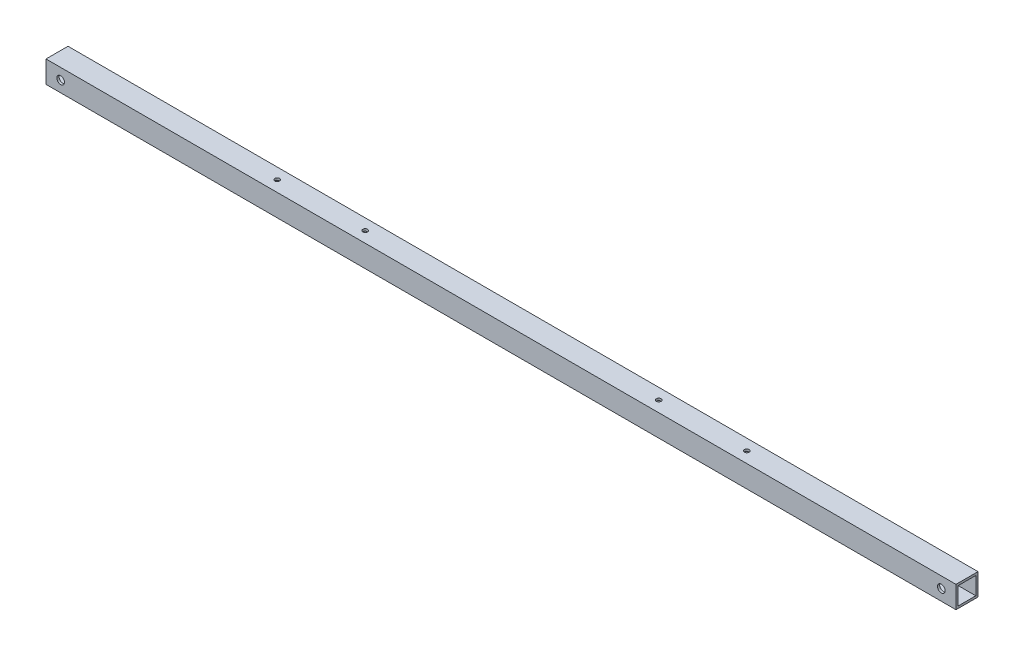
from build123d import *

# Parameters (mm, degrees)
SKETCH_2_W          = 620
SKETCH_2_H          = 15
SKETCH_2_R          = 2.6
EXTRUDE_1_DEPTH     = 15
SKETCH_3_W          = 12
SKETCH_3_H          = 12
CUT_EXTRUDE_1_DEPTH = 621.362797079
SKETCH_4_R          = 1.6
CUT_EXTRUDE_2_DEPTH = 621.362797079


with BuildPart() as part:
    # ｽｹｯﾁ2 → ﾎﾞｽ - 押し出し1 (new body)
    with BuildSketch(Plane.XY):
        with Locations((310, 7.5)):
            Rectangle(SKETCH_2_W, SKETCH_2_H)
        with Locations((10, 7.5)):
            Circle(SKETCH_2_R, mode=Mode.SUBTRACT)
        with Locations((610, 7.5)):
            Circle(SKETCH_2_R, mode=Mode.SUBTRACT)
    extrude(amount=EXTRUDE_1_DEPTH)

    # ｽｹｯﾁ3 → ｶｯﾄ - 押し出し1 (cut, through all)
    with BuildSketch(Plane.ZY):
        with Locations((7.5, 7.5)):
            Rectangle(SKETCH_3_W, SKETCH_3_H)
    extrude(amount=-CUT_EXTRUDE_1_DEPTH, mode=Mode.SUBTRACT)

    # ｽｹｯﾁ4 → ｶｯﾄ - 押し出し2 (cut, through all)
    with BuildSketch(Plane(origin=(0, 15, 0), x_dir=(1, 0, 0), z_dir=(0, 1, 0))):
        with Locations(Location((470, -7.5, 0), (0, 0, 270))):
            Circle(SKETCH_4_R)
        with Locations(Location((410, -7.5, 0), (0, 0, 270))):
            Circle(SKETCH_4_R)
        with Locations(Location((150, -7.5, 0), (0, 0, 270))):
            Circle(SKETCH_4_R)
        with Locations(Location((210, -7.5, 0), (0, 0, 270))):
            Circle(SKETCH_4_R)
    extrude(amount=-CUT_EXTRUDE_2_DEPTH, mode=Mode.SUBTRACT)


solid = part.part
